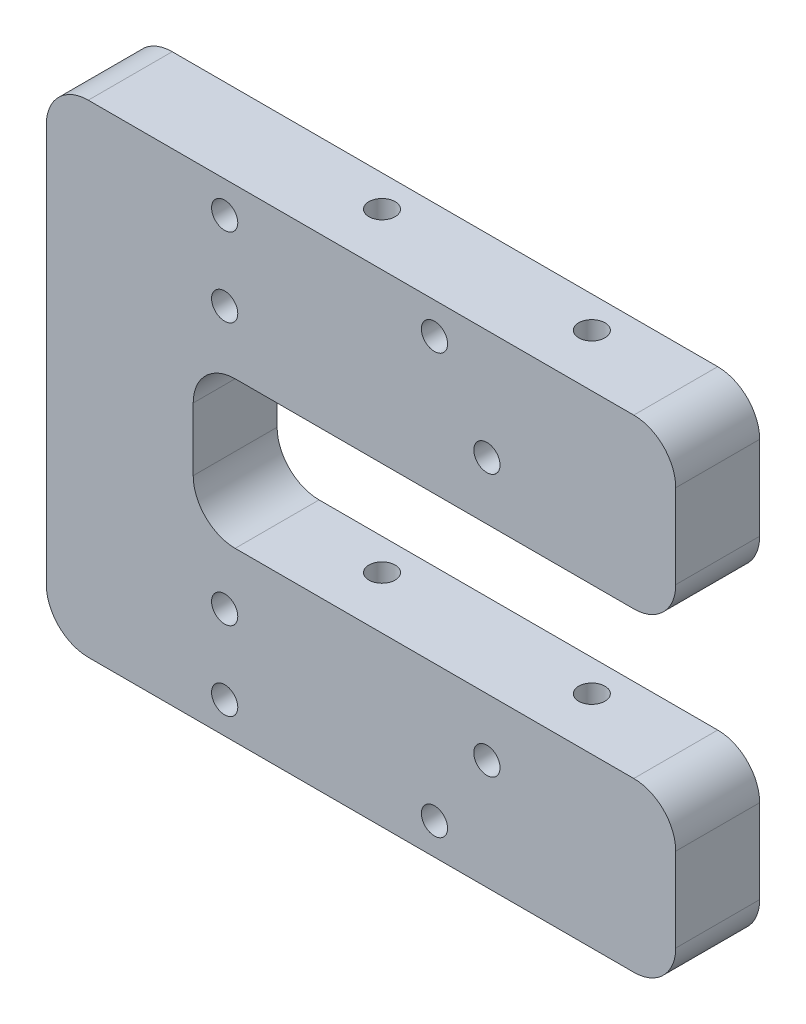
from build123d import *

# Parameters (mm, degrees)
SKETCH_1_R          = 1.25
EXTRUDE_1_DEPTH     = 8
FILLET_1_R          = 4
SKETCH_2_R          = 1.25
CUT_EXTRUDE_1_DEPTH = 10
SKETCH_3_R          = 1.25
CUT_EXTRUDE_2_DEPTH = 67


with BuildPart() as part:
    # 草图1 → 凸台-拉伸1 (new body)
    # profile 1 of 2: a face of its own
    with BuildSketch(Plane.XY):
        Polygon((0, 46), (0, 23), (14, 23), (14, 30), (60, 30), (60, 46), align=None)
        with Locations((17, 35.5)):
            Circle(SKETCH_1_R, mode=Mode.SUBTRACT)
        with Locations((42, 35.5)):
            Circle(SKETCH_1_R, mode=Mode.SUBTRACT)
    # profile 2 of 2: a face of its own
    with BuildSketch(Plane.XY):
        Polygon((14, 23), (0, 23), (0, 0), (60, 0), (60, 16), (14, 16), align=None)
        with Locations((17, 10.5)):
            Circle(SKETCH_1_R, mode=Mode.SUBTRACT)
        with Locations((42, 10.5)):
            Circle(SKETCH_1_R, mode=Mode.SUBTRACT)
    extrude(amount=EXTRUDE_1_DEPTH)

    # 圆角1
    fillet_1_edges = [part.edges().sort_by_distance(p)[0] for p in [
        (0, 46, 4),
        (60, 46, 4),
        (60, 30, 4),
        (14, 30, 4),
        (14, 16, 4),
        (60, 16, 4),
        (60, 0, 4),
        (0, 0, 4),
    ]]
    fillet(fillet_1_edges, radius=FILLET_1_R)

    # 草图2 → 切除-拉伸1 (cut)
    with BuildSketch(Plane.XY.offset(8)):
        with Locations((17, 3)):
            Circle(SKETCH_2_R)
        with Locations((37, 3)):
            Circle(SKETCH_2_R)
        with Locations((37, 43)):
            Circle(SKETCH_2_R)
        with Locations((17, 43)):
            Circle(SKETCH_2_R)
    extrude(amount=-CUT_EXTRUDE_1_DEPTH, mode=Mode.SUBTRACT)

    # 草图3 → 切除-拉伸2 (cut)
    with BuildSketch(Plane(origin=(0, 46, 0), x_dir=(1, 0, 0), z_dir=(0, 1, 0))):
        with Locations(Location((27, -3, 0), (0, 0, 270))):
            Circle(SKETCH_3_R)
        with Locations(Location((47, -3, 0), (0, 0, 270))):
            Circle(SKETCH_3_R)
    extrude(amount=-CUT_EXTRUDE_2_DEPTH, mode=Mode.SUBTRACT)


solid = part.part
